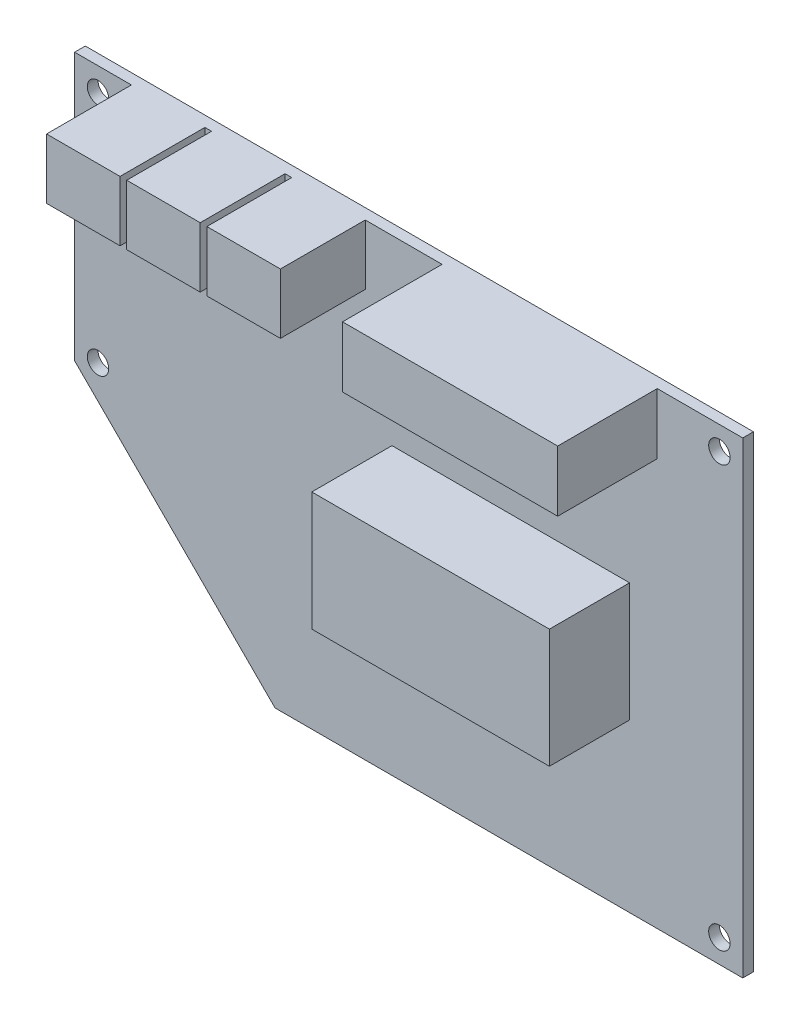
from build123d import *

# Parameters (mm, degrees)
ESQUISSE1_R        = 1.6
BOSS_EXTRU_1_DEPTH = 1.6
ESQUISSE2_W        = 11
ESQUISSE2_H        = 9
BOSS_EXTRU_2_DEPTH = 12.7
ESQUISSE3_W        = 32.2
ESQUISSE3_H        = 9.1
BOSS_EXTRU_3_DEPTH = 14.9
ESQUISSE4_W        = 35.56
ESQUISSE4_H        = 17.78
BOSS_EXTRU_4_DEPTH = 12


with BuildPart() as part:
    # Esquisse1 → Boss.-Extru.1 (new body)
    with BuildSketch(Plane.XY):
        Polygon((0, 0), (100, 0), (100, -70), (30, -70), (0, -40), align=None)
        with Locations((3.5, -3.5)):
            Circle(ESQUISSE1_R, mode=Mode.SUBTRACT)
        with Locations((96.5, -3.5)):
            Circle(ESQUISSE1_R, mode=Mode.SUBTRACT)
        with Locations((3.5, -38.5)):
            Circle(ESQUISSE1_R, mode=Mode.SUBTRACT)
        with Locations((96.5, -66.5)):
            Circle(ESQUISSE1_R, mode=Mode.SUBTRACT)
    extrude(amount=BOSS_EXTRU_1_DEPTH)

    # Esquisse2 → Boss.-Extru.2 (add)
    with BuildSketch(Plane.XY.offset(1.6)):
        with Locations((14, -4.5)):
            Rectangle(ESQUISSE2_W, ESQUISSE2_H)
        with Locations((26, -4.5)):
            Rectangle(ESQUISSE2_W, ESQUISSE2_H)
        with Locations((38, -4.5)):
            Rectangle(ESQUISSE2_W, ESQUISSE2_H)
    extrude(amount=BOSS_EXTRU_2_DEPTH)

    # Esquisse3 → Boss.-Extru.3 (add)
    with BuildSketch(Plane.XY.offset(1.6)):
        with Locations((71.1, -4.55)):
            Rectangle(ESQUISSE3_W, ESQUISSE3_H)
    extrude(amount=BOSS_EXTRU_3_DEPTH)

    # Esquisse4 → Boss.-Extru.4 (add)
    with BuildSketch(Plane.XY.offset(1.6)):
        with Locations((65.28, -36.14)):
            Rectangle(ESQUISSE4_W, ESQUISSE4_H)
    extrude(amount=BOSS_EXTRU_4_DEPTH)


solid = part.part
